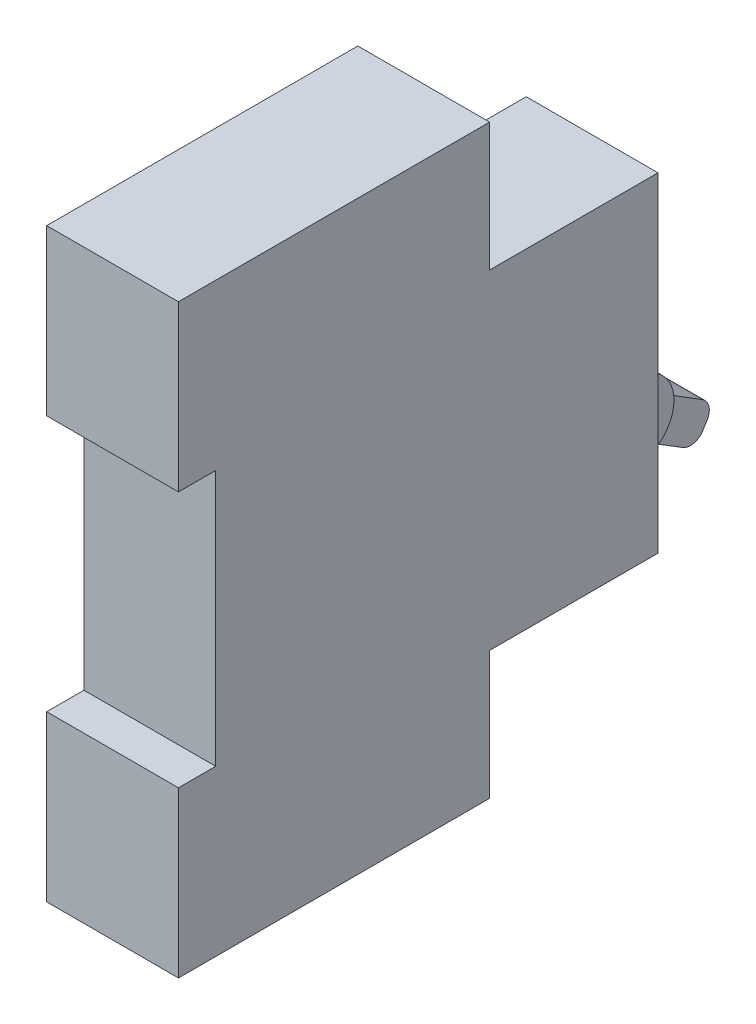
from build123d import *

# Parameters (mm, degrees)
EXTRUDE_1_DEPTH      = 9
EXTRUDE_1_DEPTH_BACK = 9
EXTRUDE_2_DEPTH      = 6
EXTRUDE_2_DEPTH_BACK = 6
EXTRUDE_3_DEPTH      = 4
EXTRUDE_3_DEPTH_BACK = 4
FILLET_2_R           = 2


with BuildPart() as part:
    # 草图1 → 凸台-拉伸1 (new, two sides: drawn at the far end of the back side and taken through both)
    with BuildSketch(Plane(origin=(0, 0, 0), x_dir=(0, 0, -1), z_dir=(1, 0, 0)).offset(-EXTRUDE_1_DEPTH_BACK)):
        Polygon((0, 17.5), (0, 40), (42.5, 40), (42.5, 22.5), (65.5, 22.5), (65.5, -22.5), (42.5, -22.5), (42.5, -40), (0, -40), (0, -17.5), (5.084959992, -17.5), (5.084959992, 17.5), align=None)
    extrude(amount=EXTRUDE_1_DEPTH + EXTRUDE_1_DEPTH_BACK)

    # 草图2 → 凸台-拉伸2 (add, two sides: drawn at the far end of the back side and taken through both)
    with BuildSketch(Plane(origin=(0, 0, 0), x_dir=(0, 0, -1), z_dir=(1, 0, 0)).offset(-EXTRUDE_2_DEPTH_BACK)):
        with BuildLine():
            Line((65.5, -3.307764834), (65.5, -13.668635082))
            ThreePointArc((65.5, -13.668635082), (70.680435124, -8.488199958), (65.5, -3.307764834))
        make_face()
    extrude(amount=EXTRUDE_2_DEPTH + EXTRUDE_2_DEPTH_BACK)

    # 草图3 → 凸台-拉伸3 (add, two sides: drawn at the far end of the back side and taken through both)
    with BuildSketch(Plane(origin=(0, 0, 0), x_dir=(0, 0, -1), z_dir=(1, 0, 0)).offset(-EXTRUDE_3_DEPTH_BACK)):
        Polygon((69.816037918, -8.168812248), (67.126357089, -12.498830138), (75.576408791, -17.747755811), (78.26608962, -13.41773792), align=None)
    extrude(amount=EXTRUDE_3_DEPTH + EXTRUDE_3_DEPTH_BACK)

    # 圆角2
    fillet_2_edges = [part.edges().sort_by_distance(p)[0] for p in [
        (0, -17.747755811, -75.576408791),
        (0, -13.41773792, -78.26608962),
    ]]
    fillet(fillet_2_edges, radius=FILLET_2_R)


solid = part.part
